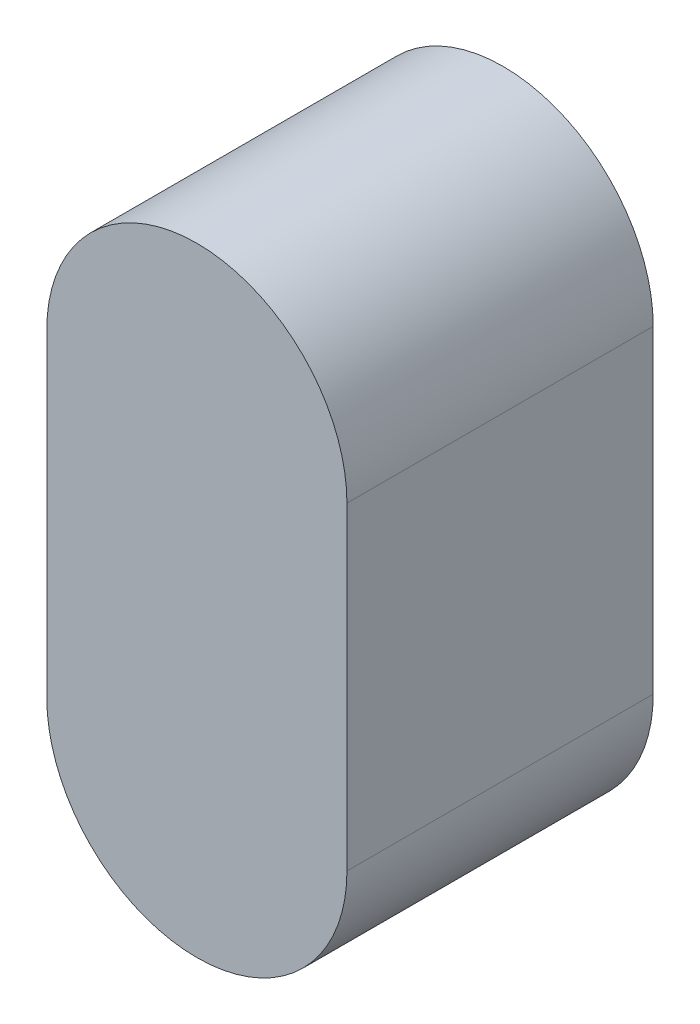
from build123d import *

# Parameters (mm, degrees)
BOSS_EXTRUDE1_DEPTH = 10


with BuildPart() as part:
    # Sketch1 → Boss-Extrude1 (new body)
    with BuildSketch(Plane.XY):
        with BuildLine():
            Line((-4.9, 4.9), (-4.9, 15.3))
            ThreePointArc((-4.9, 15.3), (0, 20.2), (4.9, 15.3))
            Line((4.9, 15.3), (4.9, 4.9))
            ThreePointArc((4.9, 4.9), (0, 0), (-4.9, 4.9))
        make_face()
    extrude(amount=BOSS_EXTRUDE1_DEPTH)


solid = part.part
